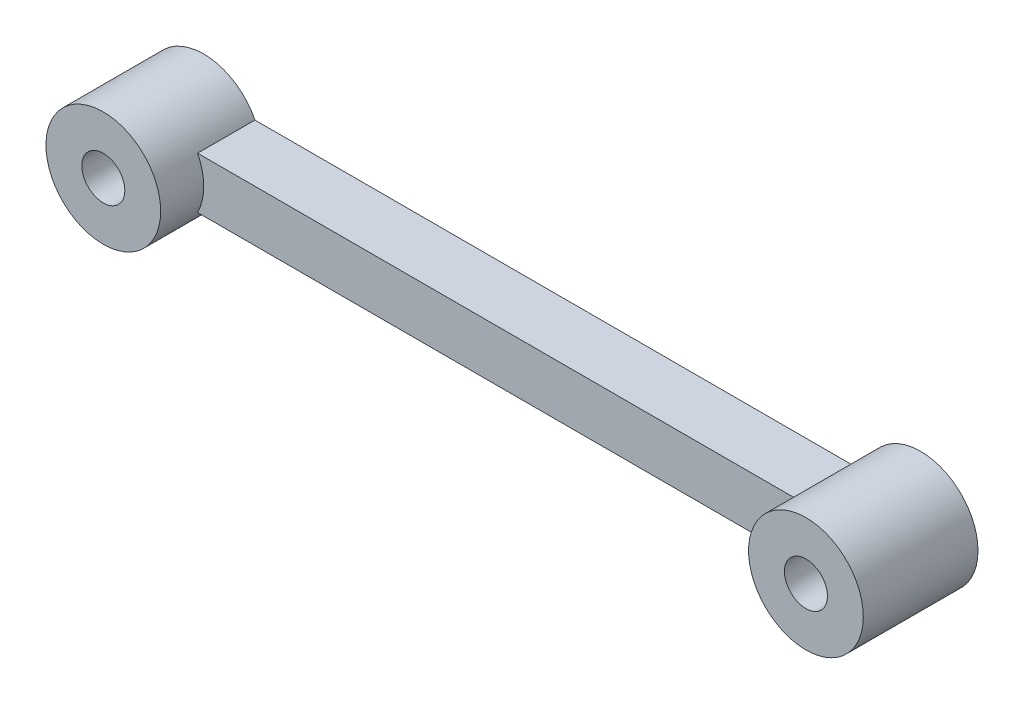
from build123d import *

# Parameters (mm, degrees)
CROQUIS1_R              = 4
CROQUIS1_R_2            = 1.5
SALIENTE_EXTRUIR1_DEPTH = 7
CROQUIS3_W              = 4
CROQUIS3_H              = 3.585282108
SALIENTE_EXTRUIR2_DEPTH = 49
CROQUIS4_R              = 4
CROQUIS4_R_2            = 1.5
SALIENTE_EXTRUIR3_DEPTH = 8
NERVIO1_REACH           = 55.61
CROQUIS6_WALL_W         = 119.09857021
CROQUIS6_WALL_H         = 1


with BuildPart() as part:
    # Croquis1 → Saliente-Extruir1 (new body)
    with BuildSketch(Plane.XY):
        with Locations((0, -10)):
            Circle(CROQUIS1_R)
        with Locations((0, -10)):
            Circle(CROQUIS1_R_2, mode=Mode.SUBTRACT)
    extrude(amount=SALIENTE_EXTRUIR1_DEPTH)

    # Croquis3 → Saliente-Extruir2 (add)
    with BuildSketch(Plane.ZY):
        with Locations((2, -10)):
            Rectangle(CROQUIS3_W, CROQUIS3_H)
    extrude(amount=-SALIENTE_EXTRUIR2_DEPTH)

    # Croquis4 → Saliente-Extruir3 (add)
    with BuildSketch(Plane.XY.offset(7)):
        with Locations((49, -10)):
            Circle(CROQUIS4_R)
        with Locations((49, -10)):
            Circle(CROQUIS4_R_2, mode=Mode.SUBTRACT)
    extrude(amount=-SALIENTE_EXTRUIR3_DEPTH)

    # Croquis6 wall → Nervio1 (add, up to next)
    with BuildSketch(Plane(origin=(42.914213562, -10, -0.5), x_dir=(-0.994863752618, 0, 0.1012230889), z_dir=(-0.1012230889, 0, -0.994863752618)), mode=Mode.PRIVATE) as nervio1_sk1:
        Rectangle(CROQUIS6_WALL_W, CROQUIS6_WALL_H)
    nervio1_tool1 = extrude(nervio1_sk1.sketch, amount=-NERVIO1_REACH, mode=Mode.PRIVATE) - part.part
    add(nervio1_tool1.solids().sort_by_distance((42.914213562, -10, -0.5))[0])


solid = part.part
